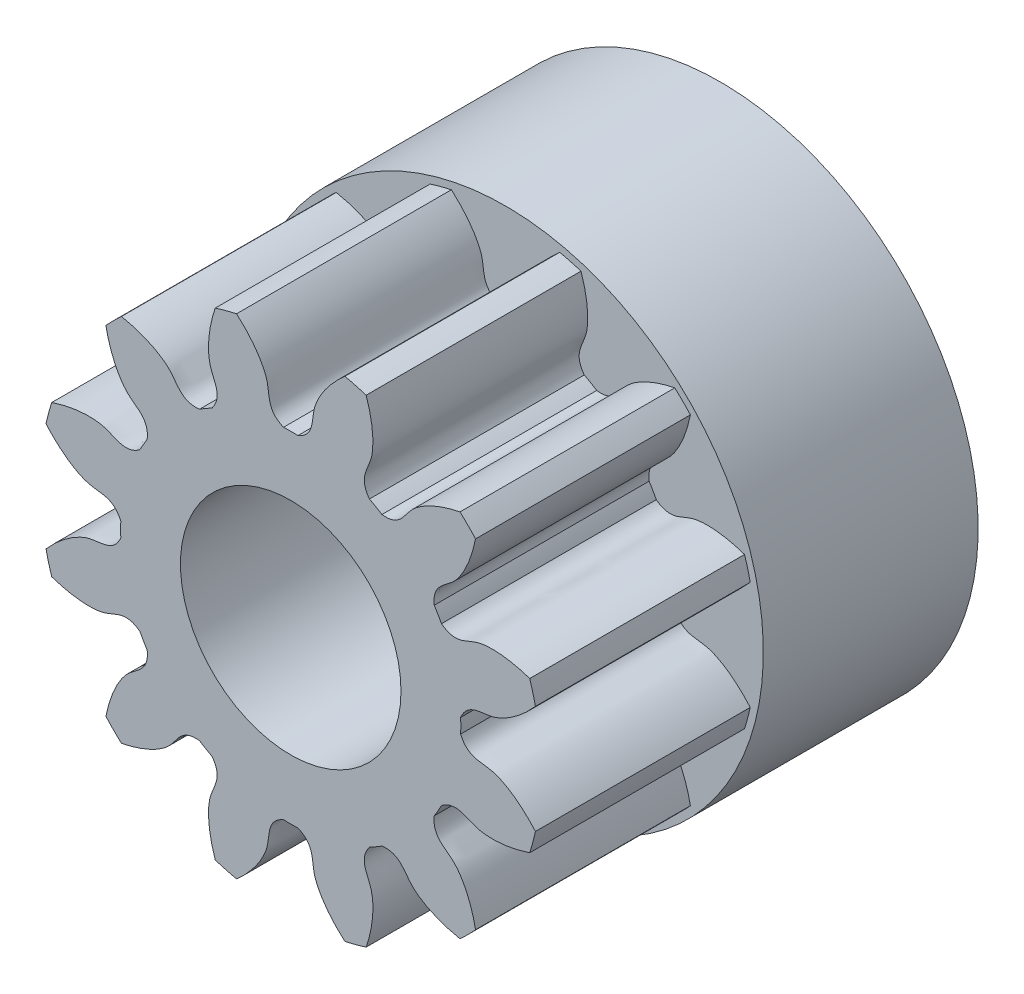
from build123d import *

# Parameters (mm, degrees)
SKETCH_1_R               = 3.5
EXTRUDE_1_DEPTH          = 3
CUT_EXTRUDE_1_DEPTH      = 6.787918451
PATTERN_CIRCULAR_1_COUNT = 12
SKETCH_5_R               = 3.6
EXTRUDE_2_DEPTH          = 3
CUT_EXTRUDE_2_REACH      = 9.869
SKETCH_4_R               = 1.54
CUT_EXTRUDE_3_REACH      = 7.909
SKETCH_6_R               = 0.825


with BuildPart() as part:
    # 草图1 → 凸台-拉伸1 (new body)
    with BuildSketch(Plane.XY):
        Circle(SKETCH_1_R)
    extrude(amount=EXTRUDE_1_DEPTH)

    # 草图2 → 切除-拉伸1 (cut, through all)
    with BuildSketch(Plane.XY):
        with BuildLine():
            ThreePointArc((0.100420056, 2.372876063), (0, 2.375), (-0.100420056, 2.372876063))
            add(Edge.make_bspline(
                [(-0.100420056, 2.372876063), (-0.340394435, 2.474653731), (-0.287186739, 2.672409341), (-0.338076094, 2.844740289), (-0.341311927, 2.854952869), (-0.345113625, 2.866166713), (-0.349521434, 2.878363044), (-0.354576313, 2.891521619), (-0.360318258, 2.905621034), (-0.36678678, 2.920638648), (-0.374020716, 2.936550626), (-0.382058239, 2.95333195), (-0.390936819, 2.970956436), (-0.400693193, 2.989396753), (-0.411363332, 3.008624444), (-0.422982412, 3.02860994), (-0.435584786, 3.049322589), (-0.449203949, 3.07073067), (-0.463872517, 3.092801417), (-0.479622192, 3.115501045), (-0.496483738, 3.138794769), (-0.514486952, 3.162646832), (-0.533660639, 3.187020528), (-0.554032585, 3.211878226), (-0.575629533, 3.237181399), (-0.598477155, 3.262890651), (-0.622600033, 3.288965742), (-0.648021632, 3.315365616), (-0.674764279, 3.342048434), (-0.702849139, 3.368971597), (-0.732296196, 3.396091781), (-0.763124233, 3.423364967), (-0.795350811, 3.450746465), (-0.828992247, 3.478190957), (-0.864063604, 3.505652518), (-0.900578664, 3.533084654), (-0.938549918, 3.560440334), (-0.977988547, 3.587672024), (-1.01890441, 3.614731718), (-1.061306025, 3.641570973), (-1.10520056, 3.668140947), (-1.150593819, 3.694392428), (-1.197490231, 3.720275872), (-1.245892835, 3.74574144), (-1.295803277, 3.770739031), (-1.347221796, 3.79521832), (-1.400147219, 3.819128792), (-1.454576948, 3.842419781), (-1.510506963, 3.865040505), (-1.567931802, 3.886940103), (-1.647189853, 3.915363979), (-1.7077968, 3.935050704), (-1.748802701, 3.947485455)],
                knots=[0, 0, 0, 0, 0.218015236, 0.222043642, 0.226545979, 0.231522246, 0.236972443, 0.24289657, 0.249294627, 0.256166614, 0.263512532, 0.271332379, 0.279626157, 0.288393865, 0.297635503, 0.307351072, 0.31754057, 0.328203999, 0.339341357, 0.350952646, 0.363037866, 0.375597015, 0.388630094, 0.402137104, 0.416118043, 0.430572913, 0.445501713, 0.460904444, 0.476781104, 0.493131694, 0.509956215, 0.527254666, 0.545027047, 0.563273358, 0.581993599, 0.601187771, 0.620855872, 0.640997904, 0.661613866, 0.682703758, 0.704267581, 0.726305333, 0.748817015, 0.771802628, 0.795262171, 0.819195644, 0.843603047, 0.868484381, 0.893839644, 0.919668838, 0.945971962, 1, 1, 1, 1], degree=3))
            ThreePointArc((-1.748802701, 3.947485455), (0, 4.317516914), (1.748802701, 3.947485455))
            add(Edge.make_bspline(
                [(0.100420056, 2.372876063), (0.340394435, 2.474653731), (0.287186739, 2.672409341), (0.338076094, 2.844740289), (0.341311927, 2.854952869), (0.345113625, 2.866166713), (0.349521434, 2.878363044), (0.354576313, 2.891521619), (0.360318258, 2.905621034), (0.36678678, 2.920638648), (0.374020716, 2.936550626), (0.382058239, 2.95333195), (0.390936819, 2.970956436), (0.400693193, 2.989396753), (0.411363332, 3.008624444), (0.422982412, 3.02860994), (0.435584786, 3.049322589), (0.449203949, 3.07073067), (0.463872517, 3.092801417), (0.479622192, 3.115501045), (0.496483738, 3.138794769), (0.514486952, 3.162646832), (0.533660639, 3.187020528), (0.554032585, 3.211878226), (0.575629533, 3.237181399), (0.598477155, 3.262890651), (0.622600033, 3.288965742), (0.648021632, 3.315365616), (0.674764279, 3.342048434), (0.702849139, 3.368971597), (0.732296196, 3.396091781), (0.763124233, 3.423364967), (0.795350811, 3.450746465), (0.828992247, 3.478190957), (0.864063604, 3.505652518), (0.900578664, 3.533084654), (0.938549918, 3.560440334), (0.977988547, 3.587672024), (1.01890441, 3.614731718), (1.061306025, 3.641570973), (1.10520056, 3.668140947), (1.150593819, 3.694392428), (1.197490231, 3.720275872), (1.245892835, 3.74574144), (1.295803277, 3.770739031), (1.347221796, 3.79521832), (1.400147219, 3.819128792), (1.454576948, 3.842419781), (1.510506963, 3.865040505), (1.567931802, 3.886940103), (1.647189853, 3.915363979), (1.7077968, 3.935050704), (1.748802701, 3.947485455)],
                knots=[0, 0, 0, 0, 0.218015236, 0.222043642, 0.226545979, 0.231522246, 0.236972443, 0.24289657, 0.249294627, 0.256166614, 0.263512532, 0.271332379, 0.279626157, 0.288393865, 0.297635503, 0.307351072, 0.31754057, 0.328203999, 0.339341357, 0.350952646, 0.363037866, 0.375597015, 0.388630094, 0.402137104, 0.416118043, 0.430572913, 0.445501713, 0.460904444, 0.476781104, 0.493131694, 0.509956215, 0.527254666, 0.545027047, 0.563273358, 0.581993599, 0.601187771, 0.620855872, 0.640997904, 0.661613866, 0.682703758, 0.704267581, 0.726305333, 0.748817015, 0.771802628, 0.795262171, 0.819195644, 0.843603047, 0.868484381, 0.893839644, 0.919668838, 0.945971962, 1, 1, 1, 1], degree=3))
        make_face()
    cut_extrude_1 = extrude(amount=CUT_EXTRUDE_1_DEPTH, mode=Mode.SUBTRACT)

    # 阵列(圆周)1: 切除-拉伸1 ×12 about axis
    pattern_circular_1_axis = Axis((0, 0, 3), (0, 0, -1))
    for i in range(1, PATTERN_CIRCULAR_1_COUNT):
        add(cut_extrude_1.rotate(pattern_circular_1_axis, i * 360 / PATTERN_CIRCULAR_1_COUNT), mode=Mode.SUBTRACT)

    # 草图5 → 凸台-拉伸2 (add)
    with BuildSketch(Plane(origin=(0, 0, 0), x_dir=(-1, 0, 0), z_dir=(0, 0, -1))):
        Circle(SKETCH_5_R)
    extrude(amount=EXTRUDE_2_DEPTH)

    # 草图4 → 切除-拉伸2 (cut, up to next)
    with BuildSketch(Plane.XY.offset(3), mode=Mode.PRIVATE) as cut_extrude_2_sk1:
        Circle(SKETCH_4_R)
    cut_extrude_2_tool1 = extrude(cut_extrude_2_sk1.sketch, amount=-CUT_EXTRUDE_2_REACH, mode=Mode.PRIVATE) & part.part
    add(cut_extrude_2_tool1.solids().sort_by_distance((0, 0, 3))[0], mode=Mode.SUBTRACT)

    # 草图6 → 切除-拉伸3 (cut, up to next)
    with BuildSketch(Plane(origin=(0, 0, 0), x_dir=(1, 0, 0), z_dir=(0, 1, 0)), mode=Mode.PRIVATE) as cut_extrude_3_sk1:
        with Locations((0, 1)):
            Circle(SKETCH_6_R)
    cut_extrude_3_tool1 = extrude(cut_extrude_3_sk1.sketch, amount=-CUT_EXTRUDE_3_REACH, mode=Mode.PRIVATE) & part.part
    add(cut_extrude_3_tool1.solids().sort_by_distance((0, 0, -1))[0], mode=Mode.SUBTRACT)


solid = part.part
